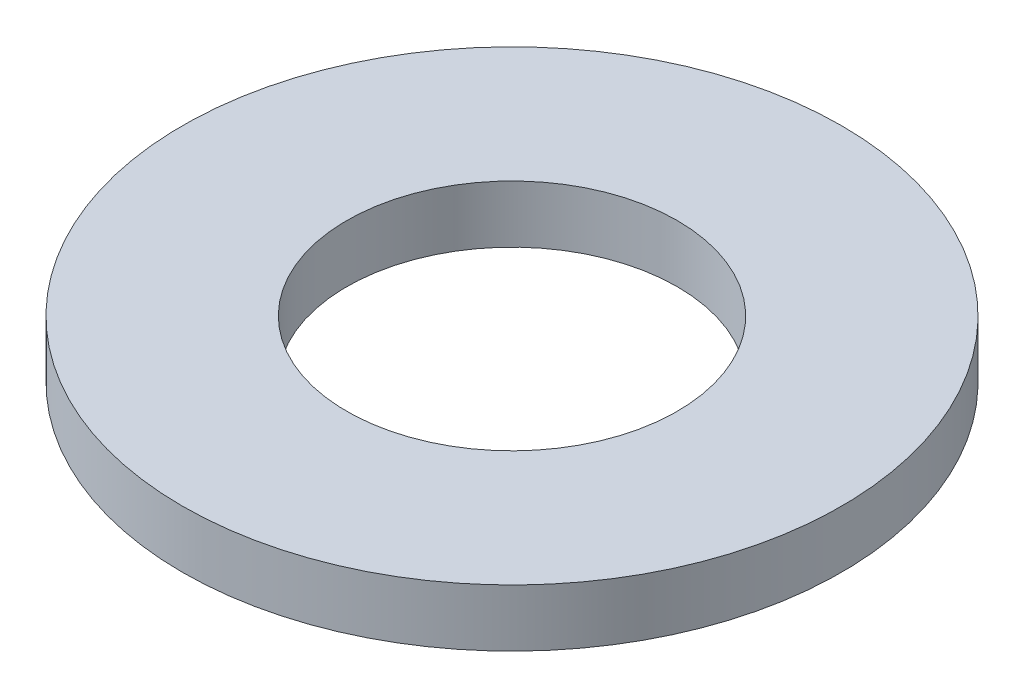
from build123d import *

# Parameters (mm, degrees)
SKETCH1_R      = 8.763
SKETCH1_R_2    = 4.3942
EXTRUDE1_DEPTH = 1.524


with BuildPart() as part:
    # Sketch1 → Extrude1 (new body)
    with BuildSketch(Plane(origin=(0, 0, 0), x_dir=(1, 0, 0), z_dir=(0, 1, 0))):
        with Locations(Location((0, 0, 0), (0, 0, 90))):
            Circle(SKETCH1_R)
        with Locations(Location((0, 0, 0), (0, 0, 90))):
            Circle(SKETCH1_R_2, mode=Mode.SUBTRACT)
    extrude(amount=EXTRUDE1_DEPTH)


solid = part.part
